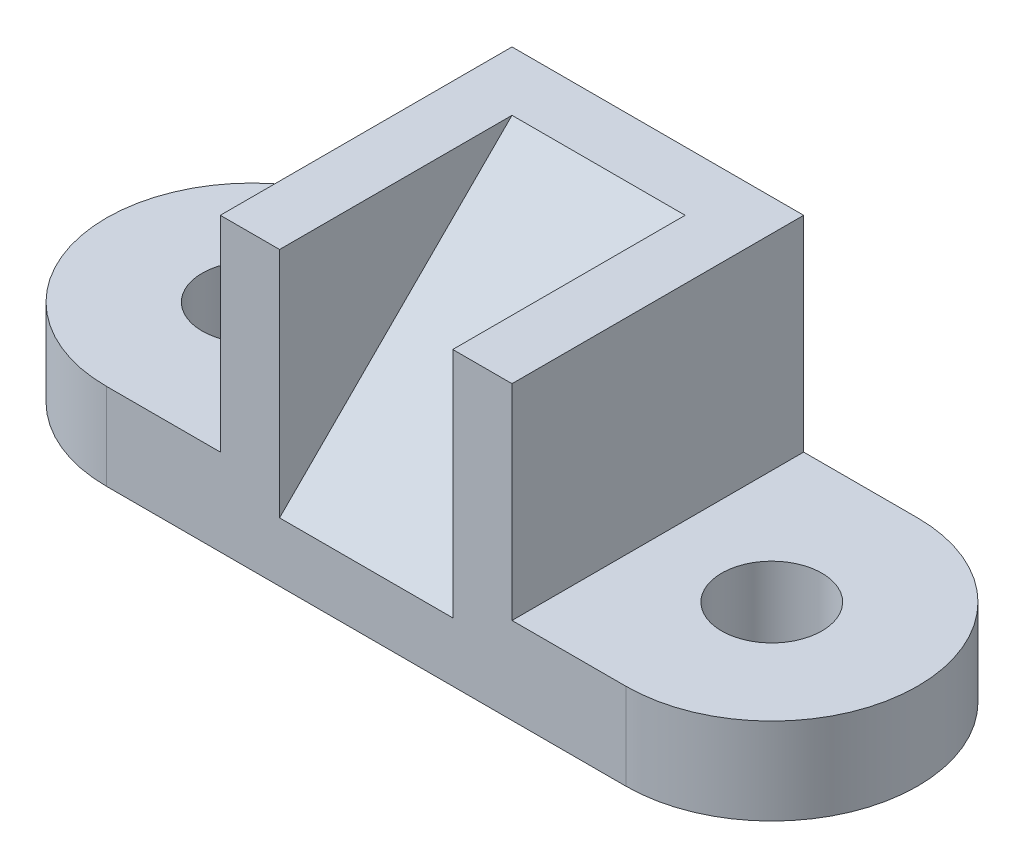
from build123d import *

# Parameters (mm, degrees)
SKETCH1_R               = 11
BOSS_EXTRUDE1_DEPTH     = 19
BOSS_EXTRUDE1_2_DEPTH   = 19
SKETCH1_3_W             = 64
SKETCH1_3_H             = 64
BOSS_EXTRUDE2_DEPTH     = 64
CUT_EXTRUDE1_DEPTH      = 19
CUT_EXTRUDE1_DEPTH_BACK = 19


with BuildPart() as part:
    # Sketch1 → Boss-Extrude1 (new body)
    with BuildSketch(Plane(origin=(0, 0, 0), x_dir=(1, 0, 0), z_dir=(0, 1, 0))):
        with BuildLine():
            Line((-32, 32), (-57, 32))
            ThreePointArc((-57, 32), (-89, 0), (-57, -32))
            Line((-57, -32), (-32, -32))
            Line((-32, -32), (-32, 32))
        make_face()
        with Locations((-57, 0)):
            Circle(SKETCH1_R, mode=Mode.SUBTRACT)
    extrude(amount=BOSS_EXTRUDE1_DEPTH)



with BuildPart() as body_2:
    # Sketch1 → Boss-Extrude1 2 (new body)
    with BuildSketch(Plane(origin=(0, 0, 0), x_dir=(1, 0, 0), z_dir=(0, 1, 0))):
        with BuildLine():
            Line((57, 32), (32, 32))
            Line((32, 32), (32, -32))
            Line((32, -32), (57, -32))
            ThreePointArc((57, -32), (89, 0), (57, 32))
        make_face()
        with Locations((57, 0)):
            Circle(SKETCH1_R, mode=Mode.SUBTRACT)
    extrude(amount=BOSS_EXTRUDE1_2_DEPTH)


with BuildPart() as part_1:
    add(part.part)

    add(body_2.part)  # Boss-Extrude2 merges body 2
    # Sketch1<3> → Boss-Extrude2 (add)
    with BuildSketch(Plane(origin=(0, 0, 0), x_dir=(1, 0, 0), z_dir=(0, 1, 0))):
        Rectangle(SKETCH1_3_W, SKETCH1_3_H)
    extrude(amount=BOSS_EXTRUDE2_DEPTH)

    # Sketch2 → Cut-Extrude1 (cut, two sides: drawn at the far end of the back side and taken through both)
    with BuildSketch(Plane.ZY.offset(-CUT_EXTRUDE1_DEPTH_BACK)):
        Polygon((32, 19), (32, 13), (-19, 64), (32, 64), align=None)
    extrude(amount=CUT_EXTRUDE1_DEPTH + CUT_EXTRUDE1_DEPTH_BACK, mode=Mode.SUBTRACT)


solid = part_1.part
